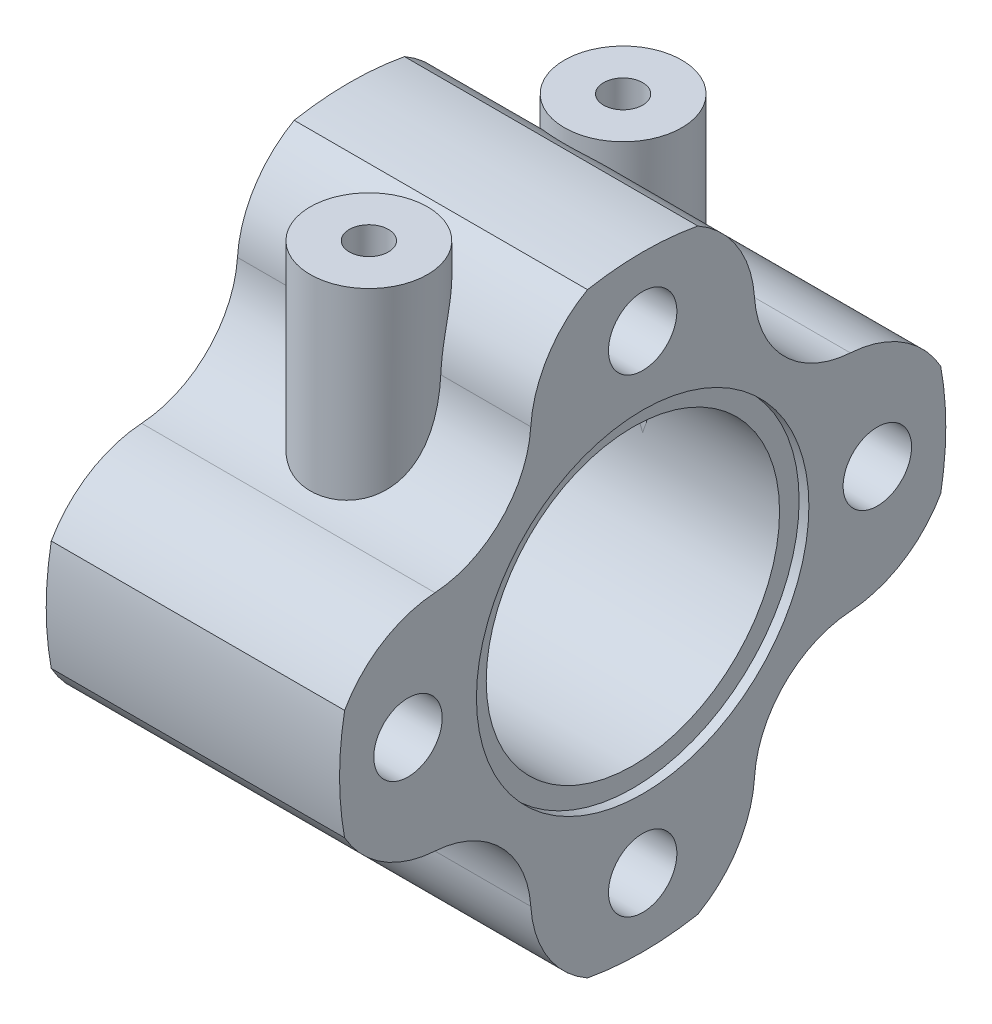
from build123d import *

# Parameters (mm, degrees)
SKETCH2_R           = 1.75
SKETCH2_R_2         = 7.5
FLANGE_DEPTH        = 15
SKETCH3_R           = 8.5
O_RING_SEAT_DEPTH   = 0.5
SKETCH5_R           = 1
OUTLET_DEPTH        = 27.561249971
BOSS_EXTRUDE2_REACH = 39.766
SKETCH6_R           = 3
SKETCH6_R_2         = 1


with BuildPart() as part:
    # Sketch2 → Flange (new body)
    with BuildSketch(Plane(origin=(0, 0, 0), x_dir=(0, 0, -1), z_dir=(1, 0, 0))):
        with BuildLine():
            ThreePointArc((-15.241152619, 2.820862781), (-15.5, 0), (-15.241152619, -2.820862781))
            ThreePointArc((-15.241152619, -2.820862781), (-13.297993041, -4.855781062), (-10.620697085, -5.721141055))
            ThreePointArc((-10.620697085, -5.721141055), (-7.247844507, -7.247844507), (-5.721141055, -10.620697085))
            ThreePointArc((-5.721141055, -10.620697085), (-4.855781062, -13.297993041), (-2.820862781, -15.241152619))
            ThreePointArc((-2.820862781, -15.241152619), (0, -15.5), (2.820862781, -15.241152619))
            ThreePointArc((2.820862781, -15.241152619), (4.855781062, -13.297993041), (5.721141055, -10.620697085))
            ThreePointArc((5.721141055, -10.620697085), (7.247844507, -7.247844507), (10.620697085, -5.721141055))
            ThreePointArc((10.620697085, -5.721141055), (13.297993041, -4.855781062), (15.241152619, -2.820862781))
            ThreePointArc((15.241152619, -2.820862781), (15.5, 0), (15.241152619, 2.820862781))
            ThreePointArc((15.241152619, 2.820862781), (13.297993041, 4.855781062), (10.620697085, 5.721141055))
            ThreePointArc((10.620697085, 5.721141055), (7.247844507, 7.247844507), (5.721141055, 10.620697085))
            ThreePointArc((5.721141055, 10.620697085), (4.855781062, 13.297993041), (2.820862781, 15.241152619))
            ThreePointArc((2.820862781, 15.241152619), (0, 15.5), (-2.820862781, 15.241152619))
            ThreePointArc((-2.820862781, 15.241152619), (-4.855781062, 13.297993041), (-5.721141055, 10.620697085))
            ThreePointArc((-5.721141055, 10.620697085), (-7.247844507, 7.247844507), (-10.620697085, 5.721141055))
            ThreePointArc((-10.620697085, 5.721141055), (-13.297993041, 4.855781062), (-15.241152619, 2.820862781))
        make_face()
        with Locations((0, 12)):
            Circle(SKETCH2_R, mode=Mode.SUBTRACT)
        with Locations((12, 0)):
            Circle(SKETCH2_R, mode=Mode.SUBTRACT)
        with Locations((0, -12)):
            Circle(SKETCH2_R, mode=Mode.SUBTRACT)
        with Locations((-12, 0)):
            Circle(SKETCH2_R, mode=Mode.SUBTRACT)
        Circle(SKETCH2_R_2, mode=Mode.SUBTRACT)
    extrude(amount=FLANGE_DEPTH)

    # Sketch3 → O-Ring Seat (cut)
    with BuildSketch(Plane(origin=(15, 0, 0), x_dir=(0, 0, -1), z_dir=(1, 0, 0))):
        Circle(SKETCH3_R)
    o_ring_seat = extrude(amount=-O_RING_SEAT_DEPTH, mode=Mode.SUBTRACT)

    # Mirror1: O-Ring Seat across plane
    add(o_ring_seat.mirror(Plane.ZY.offset(-7.5)), mode=Mode.SUBTRACT)

    # Sketch5 → Outlet (cut, through all)
    with BuildSketch(Plane(origin=(0, 0, 0), x_dir=(1, 0, 0), z_dir=(0, 1, 0))):
        with Locations(Location((7.5, 6.5, 0), (0, 0, 90))):
            Circle(SKETCH5_R)
    outlet = extrude(amount=OUTLET_DEPTH, mode=Mode.SUBTRACT)

    # Sketch6 → Boss-Extrude2 (add, up to next)
    with BuildSketch(Plane(origin=(0, 15.5, 0), x_dir=(1, 0, 0), z_dir=(0, 1, 0)), mode=Mode.PRIVATE) as boss_extrude2_sk1:
        with Locations(Location((7.5, 6.5, 0), (0, 0, 270))):
            Circle(SKETCH6_R)
        with Locations(Location((7.5, 6.5, 0), (0, 0, 90))):
            Circle(SKETCH6_R_2, mode=Mode.SUBTRACT)
    boss_extrude2_tool1 = extrude(boss_extrude2_sk1.sketch, amount=-BOSS_EXTRUDE2_REACH, mode=Mode.PRIVATE) - part.part
    boss_extrude2 = boss_extrude2_tool1.solids().sort_by_distance((7.5, 15.5, -9.415147))[0]
    add(boss_extrude2)

    # Inlet: Outlet, Boss-Extrude2 across plane
    add(outlet.mirror(Plane.XY), mode=Mode.SUBTRACT)
    add(boss_extrude2.mirror(Plane.XY))


solid = part.part
